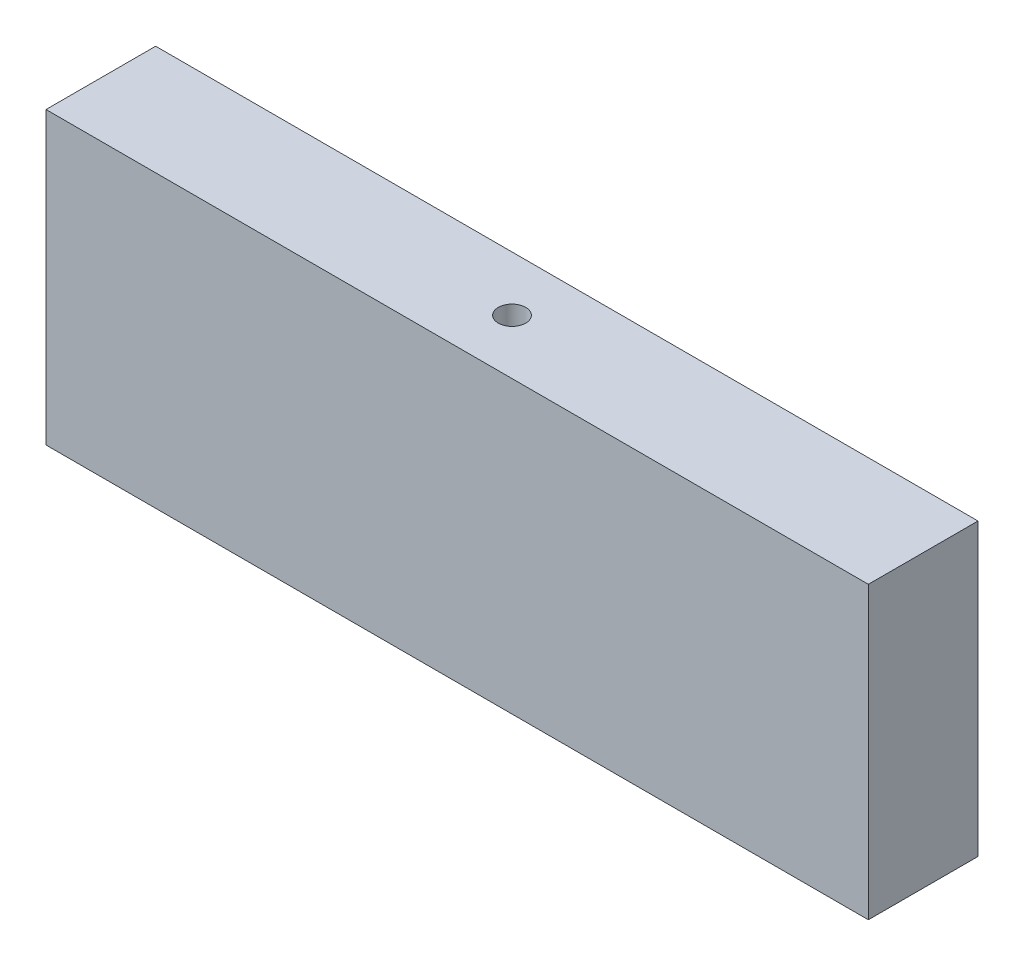
from build123d import *

# Parameters (mm, degrees)
SKETCH_1_W               = 150
SKETCH_1_H               = 53
EXTRUDE_1_DEPTH          = 10
CUT_EXTRUDE_1_DEPTH      = 81.170131595
CUT_EXTRUDE_1_DEPTH_BACK = 81.170131595
SKETCH_2_R               = 2.5


with BuildPart() as part:
    # Эскиз1 → Бобышка-Вытянуть1 (new, symmetric)
    with BuildSketch(Plane.XY):
        Rectangle(SKETCH_1_W, SKETCH_1_H)
    extrude(amount=EXTRUDE_1_DEPTH, both=True)

    # Эскиз2 → Вырез-Вытянуть1 (cut, two sides: drawn at the far end of the back side and taken through both)
    with BuildSketch(Plane(origin=(0, 0, 0), x_dir=(1, 0, 0), z_dir=(0, 1, 0)).offset(-CUT_EXTRUDE_1_DEPTH_BACK)):
        with Locations(Location((0, 0, 0), (0, 0, 270))):
            Circle(SKETCH_2_R)
    extrude(amount=CUT_EXTRUDE_1_DEPTH + CUT_EXTRUDE_1_DEPTH_BACK, mode=Mode.SUBTRACT)


solid = part.part
